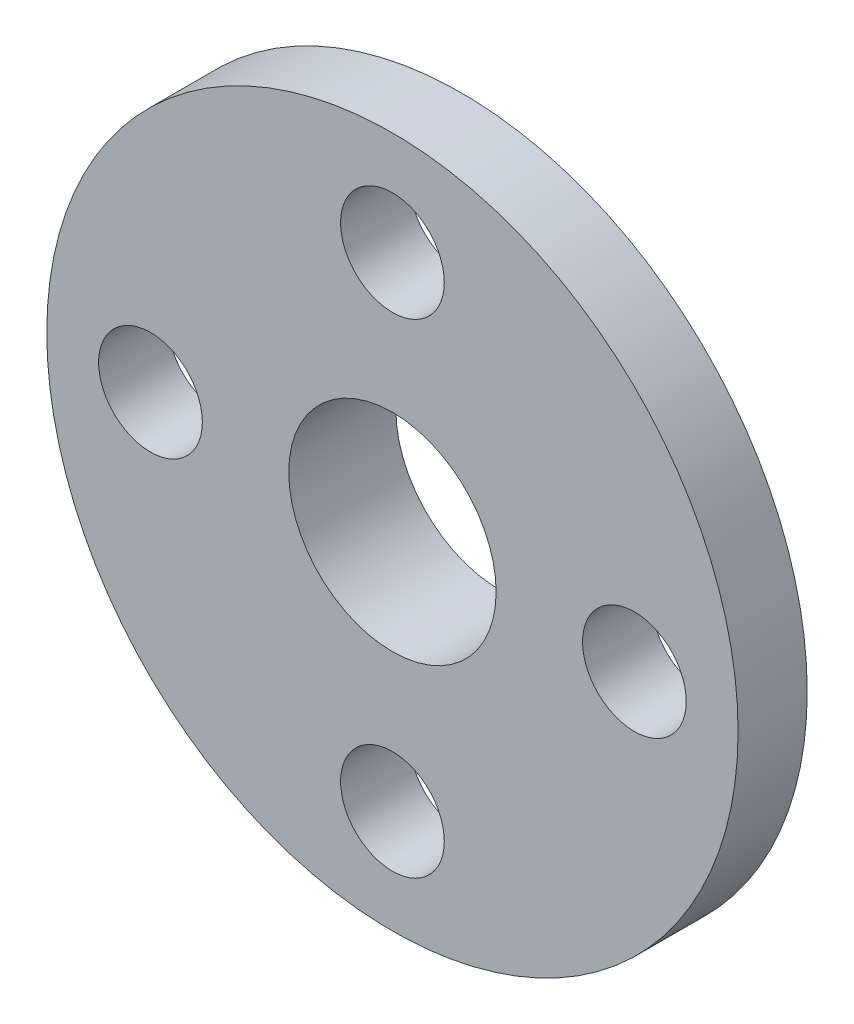
from build123d import *
from build123d.topology import SkipClean

# Parameters (mm, degrees)
SKETCH_1_R      = 10
SKETCH_1_R_2    = 3
SKETCH_1_R_3    = 1.5
EXTRUDE_1_DEPTH = 2
EXTRUDE_START   = 1.1
SKETCH_2_R      = 4.5
SKETCH_2_R_2    = 3
EXTRUDE_2_DEPTH = 1.1


with BuildPart() as part:
    # ｽｹｯﾁ1 → ﾎﾞｽ - 押し出し1 (new body)
    with BuildSketch(Plane.XY):
        Circle(SKETCH_1_R)
        Circle(SKETCH_1_R_2, mode=Mode.SUBTRACT)
        with Locations((-7, 0)):
            Circle(SKETCH_1_R_3, mode=Mode.SUBTRACT)
        with Locations((7, 0)):
            Circle(SKETCH_1_R_3, mode=Mode.SUBTRACT)
        with Locations((0, 7)):
            Circle(SKETCH_1_R_3, mode=Mode.SUBTRACT)
        with Locations((0, -7)):
            Circle(SKETCH_1_R_3, mode=Mode.SUBTRACT)
    extrude(amount=EXTRUDE_1_DEPTH)

    # ｽｹｯﾁ2 → ﾎﾞｽ - 押し出し2 (add)
    with SkipClean():  # the faces are left unmerged after this step: merging them gives an invalid solid
        with BuildSketch(Plane(origin=(0, 0, 0), x_dir=(-1, 0, 0), z_dir=(0, 0, -1)).offset(EXTRUDE_START)):
            with Locations(Location((0, 0, 0), (0, 0, 180))):
                Circle(SKETCH_2_R)
            Circle(SKETCH_2_R_2, mode=Mode.SUBTRACT)
        extrude(amount=-EXTRUDE_2_DEPTH)


solid = part.part
